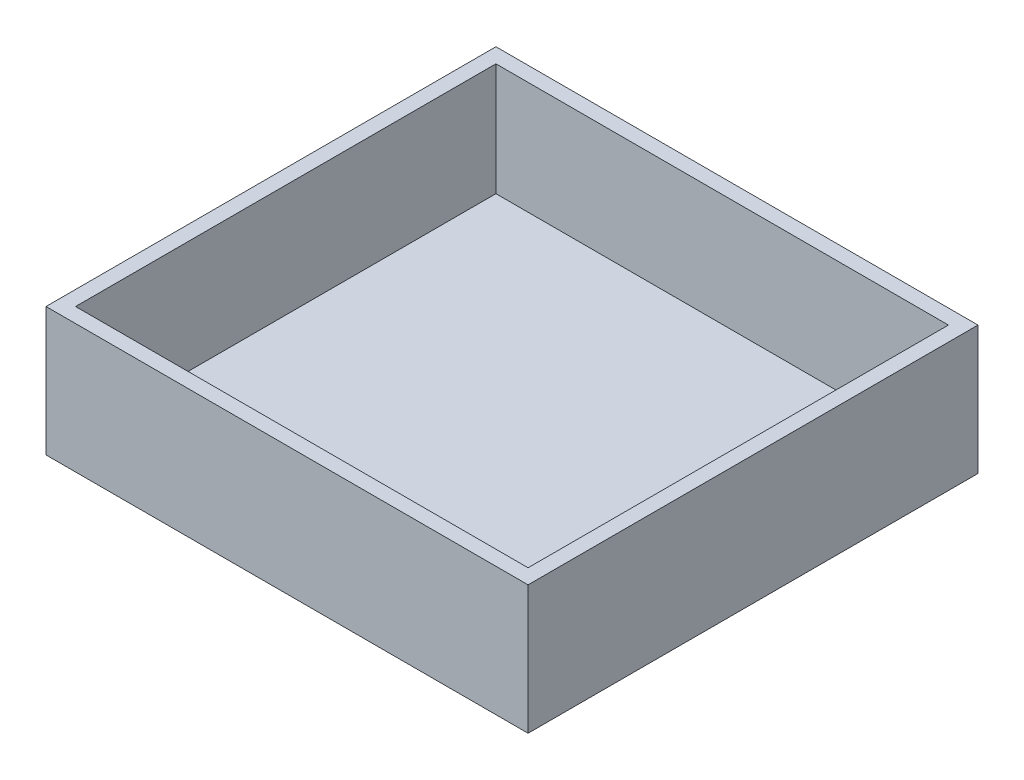
from build123d import *

# Parameters (mm, degrees)
SKETCH1_W           = 190.5
SKETCH1_H           = 177.8
BOSS_EXTRUDE1_DEPTH = 50.8
SKETCH2_W           = 178.816
SKETCH2_H           = 166.116
CUT_EXTRUDE1_DEPTH  = 44.45


with BuildPart() as part:
    # Sketch1 → Boss-Extrude1 (new body)
    with BuildSketch(Plane(origin=(0, 0, 0), x_dir=(1, 0, 0), z_dir=(0, 1, 0))):
        Rectangle(SKETCH1_W, SKETCH1_H)
    extrude(amount=BOSS_EXTRUDE1_DEPTH)

    # Sketch2 → Cut-Extrude1 (cut)
    with BuildSketch(Plane(origin=(0, 50.8, 0), x_dir=(1, 0, 0), z_dir=(0, 1, 0))):
        Rectangle(SKETCH2_W, SKETCH2_H)
    extrude(amount=-CUT_EXTRUDE1_DEPTH, mode=Mode.SUBTRACT)


solid = part.part
